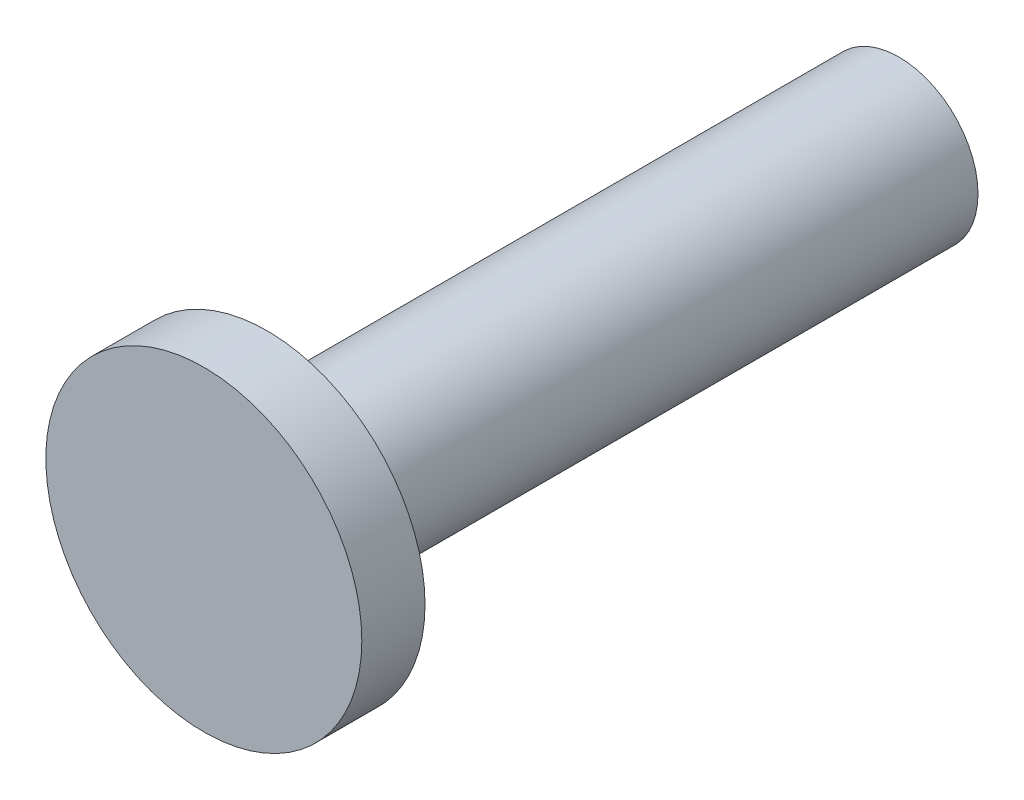
from build123d import *

# Parameters (mm, degrees)
SKETCH1_R           = 3.175
BOSS_EXTRUDE1_DEPTH = 25.4
SKETCH4_R           = 6.35
BOSS_EXTRUDE2_DEPTH = 2.54


with BuildPart() as part:
    # Sketch1 → Boss-Extrude1 (new body)
    with BuildSketch(Plane.XY):
        with Locations((-16.531006734, 16.812785258)):
            Circle(SKETCH1_R)
    extrude(amount=BOSS_EXTRUDE1_DEPTH)

    # Sketch4 → Boss-Extrude2 (add)
    with BuildSketch(Plane.XY.offset(25.4)):
        with Locations((-16.5310058, 16.8127934)):
            Circle(SKETCH4_R)
    extrude(amount=BOSS_EXTRUDE2_DEPTH)


solid = part.part
